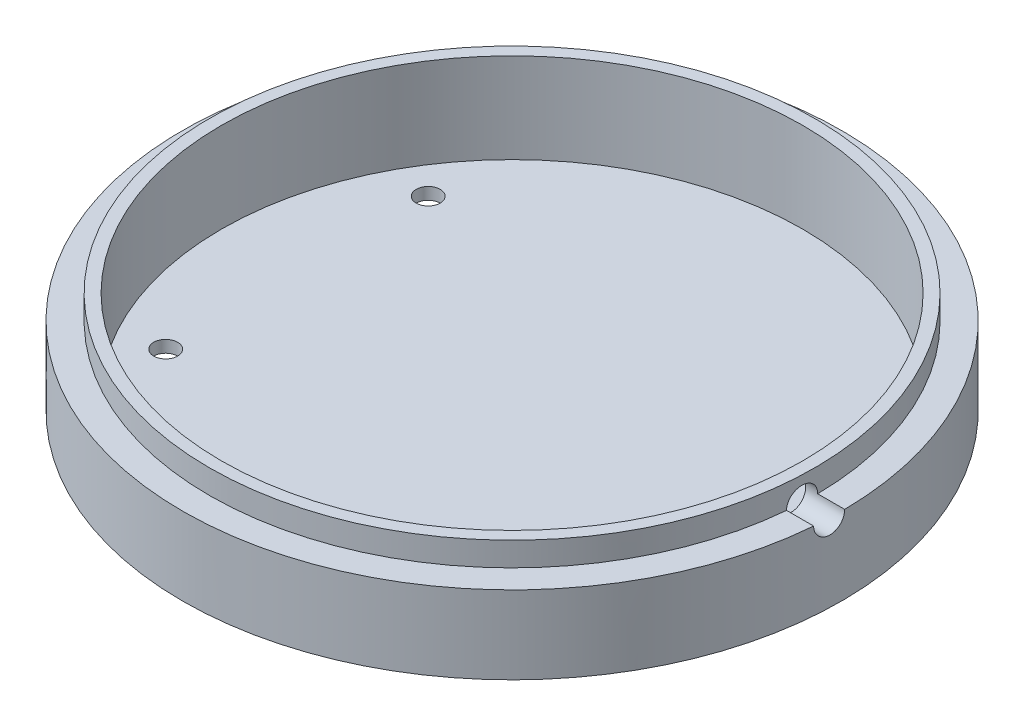
from build123d import *

# Parameters (mm, degrees)
SKETCH2_R                = 55
BOSS_EXTRUDE2_DEPTH      = 13
SKETCH7_R                = 50.5
BOSS_EXTRUDE3_DEPTH      = 4
SKETCH8_R                = 48.5
CUT_EXTRUDE3_DEPTH       = 15
SKETCH9_R                = 2
SKETCH9_W                = 3.162660916
SKETCH9_H                = 2.60493009
CUT_EXTRUDE4_DEPTH       = 15
CUT_EXTRUDE5_DEPTH       = 20
CUT_EXTRUDE5_DEPTH_BACK  = 1
SKETCH10_R               = 2.5
BOSS_EXTRUDE5_DEPTH      = 0.01
BOSS_EXTRUDE5_DEPTH_BACK = 2
SKETCH11_W               = 6.274273212
SKETCH11_H               = 7.379534018


with BuildPart() as part:
    # Sketch2 → Boss-Extrude2 (new body)
    with BuildSketch(Plane(origin=(0, 0, 0), x_dir=(1, 0, 0), z_dir=(0, 1, 0))):
        with Locations(Location((0, 0, 0), (0, 0, 90))):
            Circle(SKETCH2_R)
    extrude(amount=BOSS_EXTRUDE2_DEPTH)

    # Sketch7 → Boss-Extrude3 (add)
    with BuildSketch(Plane(origin=(0, 13, 0), x_dir=(1, 0, 0), z_dir=(0, 1, 0))):
        with Locations(Location((0, 0, 0), (0, 0, 270))):
            Circle(SKETCH7_R)
    extrude(amount=BOSS_EXTRUDE3_DEPTH)

    # Sketch8 → Cut-Extrude3 (cut)
    with BuildSketch(Plane(origin=(0, 17, 0), x_dir=(1, 0, 0), z_dir=(0, 1, 0))):
        with Locations(Location((0, 0, 0), (0, 0, 270))):
            Circle(SKETCH8_R)
    extrude(amount=-CUT_EXTRUDE3_DEPTH, mode=Mode.SUBTRACT)

    # Sketch9 → Cut-Extrude4 (cut)
    with BuildSketch(Plane(origin=(0, 2, 0), x_dir=(1, 0, 0), z_dir=(0, 1, 0))):
        with Locations(Location((36, -22, 0), (0, 0, 270))):
            Circle(SKETCH9_R)
        with Locations(Location((-36, 22, 0), (0, 0, 270))):
            Circle(SKETCH9_R)
        with Locations(Location((-35.8, -22, 0), (0, 0, 270))):
            Circle(SKETCH9_R)
        with Locations(Location((36, 22, 0), (0, 0, 270))):
            Circle(SKETCH9_R)
        with Locations((37.581330458, -0.802465045)):
            Rectangle(SKETCH9_W, SKETCH9_H)
    extrude(amount=-CUT_EXTRUDE4_DEPTH, mode=Mode.SUBTRACT)

    # Sketch10 → Cut-Extrude5 (cut, two sides: drawn at the far end of the back side and taken through both)
    with BuildSketch(Plane(origin=(36, 0, 0), x_dir=(0, 0, -1), z_dir=(1, 0, 0)).offset(-CUT_EXTRUDE5_DEPTH_BACK)):
        with Locations(Location((-2, 13, 0), (0, 0, 180))):
            Circle(SKETCH10_R)
    extrude(amount=CUT_EXTRUDE5_DEPTH + CUT_EXTRUDE5_DEPTH_BACK, mode=Mode.SUBTRACT)

    # Sketch11 → Boss-Extrude5 (add, two sides: drawn at the far end of the back side and taken through both)
    with BuildSketch(Plane(origin=(0, 2, 0), x_dir=(1, 0, 0), z_dir=(0, 1, 0)).offset(-BOSS_EXTRUDE5_DEPTH_BACK)):
        with Locations((37.193701051, -0.388212482)):
            Rectangle(SKETCH11_W, SKETCH11_H)
    extrude(amount=BOSS_EXTRUDE5_DEPTH + BOSS_EXTRUDE5_DEPTH_BACK)


solid = part.part
